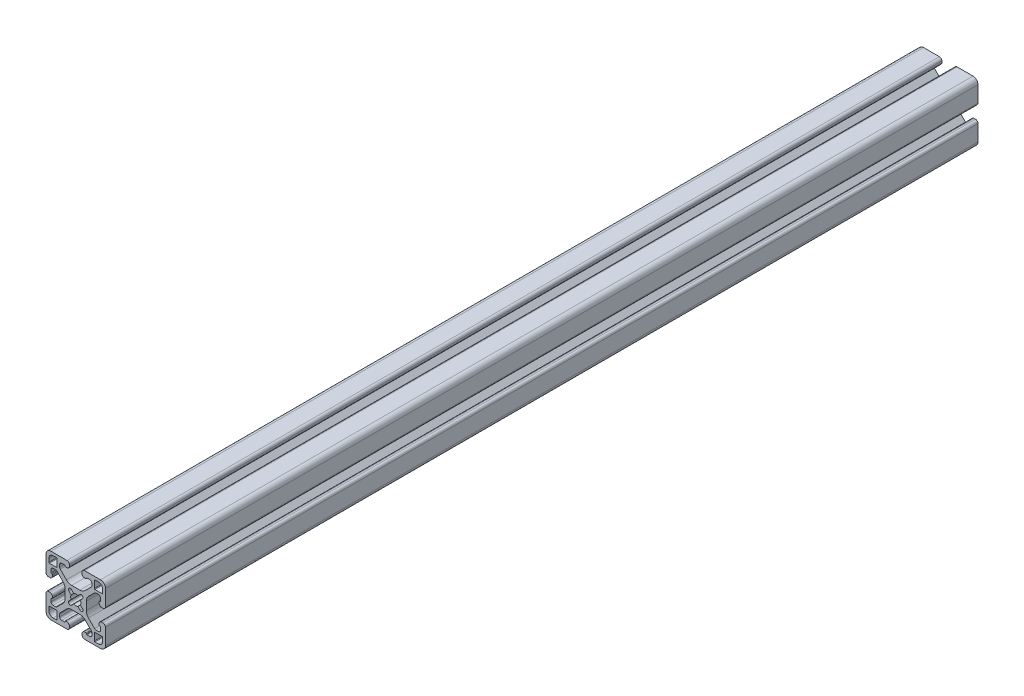
from build123d import *

# Parameters (mm, degrees)
EXTRUDE1_DEPTH = 558.8


with BuildPart() as part:
    # Sketch1 → Extrude1 (new body)
    with BuildSketch(Plane.XY):
        with BuildLine():
            Line((-46.536752228, -7.000622168), (-46.536752228, -8.774580164))
            ThreePointArc((-46.536752228, -8.774580164), (-46.907290083, -9.675221514), (-47.806745776, -10.048628264))
            Line((-47.806745776, -10.048628264), (-49.392633083, -10.048628264))
            ThreePointArc((-49.392633083, -10.048628264), (-49.878641042, -9.95195527), (-50.290658695, -9.676653876))
            Line((-50.290658695, -9.676653876), (-54.238761565, -5.728551005))
            ThreePointArc((-54.238761565, -5.728551005), (-55.26838878, -4.187604983), (-55.629945776, -2.369935216))
            Line((-55.629945776, -2.369935216), (-55.629945776, 2.846678689))
            ThreePointArc((-55.629945776, 2.846678689), (-55.26838878, 4.664348456), (-54.238761565, 6.205294478))
            Line((-54.238761565, 6.205294478), (-50.290658695, 10.153397348))
            ThreePointArc((-50.290658695, 10.153397348), (-49.878641042, 10.428698742), (-49.392633083, 10.525371736))
            Line((-49.392633083, 10.525371736), (-47.806745776, 10.525371736))
            ThreePointArc((-47.806745776, 10.525371736), (-46.907290079, 10.151964982), (-46.536752228, 9.251323623))
            Line((-46.536752228, 9.251323623), (-46.536752228, 7.47736564))
            ThreePointArc((-46.536752228, 7.47736564), (-46.648344767, 7.207957418), (-46.91775299, 7.096364878))
            Line((-46.91775299, 7.096364878), (-46.993953142, 7.096364878))
            ThreePointArc((-46.993953142, 7.096364878), (-47.263362671, 6.984771032), (-47.374953904, 6.715360422))
            Line((-47.374953904, 6.715360422), (-47.374945776, 5.877156465))
            ThreePointArc((-47.374945776, 5.877156465), (-46.913692136, 4.763614578), (-45.800145776, 4.302371736))
            Line((-45.800145776, 4.302371736), (-44.885745776, 4.302371736))
            ThreePointArc((-44.885745776, 4.302371736), (-43.772194017, 4.763619977), (-43.310945776, 5.877171736))
            Line((-43.310945776, 5.877171736), (-43.310945776, 16.113371736))
            ThreePointArc((-43.310945776, 16.113371736), (-44.240881746, 18.358435766), (-46.485945776, 19.288371736))
            Line((-46.485945776, 19.288371736), (-56.722145776, 19.288371736))
            ThreePointArc((-56.722145776, 19.288371736), (-57.835697535, 18.827123495), (-58.296945776, 17.713571736))
            Line((-58.296945776, 17.713571736), (-58.296945776, 16.799171736))
            ThreePointArc((-58.296945776, 16.799171736), (-57.835702934, 15.685625376), (-56.722161047, 15.224371736))
            Line((-56.722161047, 15.224371736), (-55.883957091, 15.224363608))
            ThreePointArc((-55.883957091, 15.224363608), (-55.61454648, 15.335954841), (-55.502952634, 15.60536437))
            Line((-55.502952634, 15.60536437), (-55.502952634, 15.681564523))
            ThreePointArc((-55.502952634, 15.681564523), (-55.391360095, 15.950972745), (-55.121951872, 16.062565285))
            Line((-55.121951872, 16.062565285), (-53.347993876, 16.062565285))
            ThreePointArc((-53.347993876, 16.062565285), (-52.447352526, 15.692027429), (-52.073945776, 14.792571736))
            Line((-52.073945776, 14.792571736), (-52.073945776, 13.206684429))
            ThreePointArc((-52.073945776, 13.206684429), (-52.17061877, 12.72067647), (-52.445920164, 12.308658817))
            Line((-52.445920164, 12.308658817), (-56.394023034, 8.360555947))
            ThreePointArc((-56.394023034, 8.360555947), (-57.934969057, 7.330928733), (-59.752638824, 6.969371736))
            Line((-59.752638824, 6.969371736), (-64.969252728, 6.969371736))
            ThreePointArc((-64.969252728, 6.969371736), (-66.786922496, 7.330928733), (-68.327868518, 8.360555947))
            Line((-68.327868518, 8.360555947), (-72.275971388, 12.308658817))
            ThreePointArc((-72.275971388, 12.308658817), (-72.551272782, 12.72067647), (-72.647945776, 13.206684429))
            Line((-72.647945776, 13.206684429), (-72.647945776, 14.792571736))
            ThreePointArc((-72.647945776, 14.792571736), (-72.274539022, 15.692027434), (-71.373897663, 16.062565285))
            Line((-71.373897663, 16.062565285), (-69.59993968, 16.062565285))
            ThreePointArc((-69.59993968, 16.062565285), (-69.330531458, 15.950972745), (-69.218938918, 15.681564523))
            Line((-69.218938918, 15.681564523), (-69.218938918, 15.60536437))
            ThreePointArc((-69.218938918, 15.60536437), (-69.107345072, 15.335954841), (-68.837934461, 15.224363608))
            Line((-68.837934461, 15.224363608), (-67.999730505, 15.224371736))
            ThreePointArc((-67.999730505, 15.224371736), (-66.886188618, 15.685625376), (-66.424945776, 16.799171736))
            Line((-66.424945776, 16.799171736), (-66.424945776, 17.713571736))
            ThreePointArc((-66.424945776, 17.713571736), (-66.886194017, 18.827123495), (-67.999745776, 19.288371736))
            Line((-67.999745776, 19.288371736), (-78.235945776, 19.288371736))
            ThreePointArc((-78.235945776, 19.288371736), (-80.481009806, 18.358435766), (-81.410945776, 16.113371736))
            Line((-81.410945776, 16.113371736), (-81.410945776, 5.877171736))
            ThreePointArc((-81.410945776, 5.877171736), (-80.949697535, 4.763619977), (-79.836145776, 4.302371736))
            Line((-79.836145776, 4.302371736), (-78.921745776, 4.302371736))
            ThreePointArc((-78.921745776, 4.302371736), (-77.808199416, 4.763614578), (-77.346945776, 5.877156465))
            Line((-77.346945776, 5.877156465), (-77.346937648, 6.715360422))
            ThreePointArc((-77.346937648, 6.715360422), (-77.458528881, 6.984771032), (-77.72793841, 7.096364878))
            Line((-77.72793841, 7.096364878), (-77.804138562, 7.096364878))
            ThreePointArc((-77.804138562, 7.096364878), (-78.073546785, 7.207957418), (-78.185139324, 7.47736564))
            Line((-78.185139324, 7.47736564), (-78.185139324, 9.251323637))
            ThreePointArc((-78.185139324, 9.251323637), (-77.814601469, 10.151964987), (-76.915145776, 10.525371736))
            Line((-76.915145776, 10.525371736), (-75.329258469, 10.525371736))
            ThreePointArc((-75.329258469, 10.525371736), (-74.84325051, 10.428698742), (-74.431232857, 10.153397348))
            Line((-74.431232857, 10.153397348), (-70.483129987, 6.205294478))
            ThreePointArc((-70.483129987, 6.205294478), (-69.453502773, 4.664348456), (-69.091945776, 2.846678689))
            Line((-69.091945776, 2.846678689), (-69.091945776, -2.369935216))
            ThreePointArc((-69.091945776, -2.369935216), (-69.453502773, -4.187604983), (-70.483129987, -5.728551005))
            Line((-70.483129987, -5.728551005), (-74.431232857, -9.676653876))
            ThreePointArc((-74.431232857, -9.676653876), (-74.84325051, -9.95195527), (-75.329258469, -10.048628264))
            Line((-75.329258469, -10.048628264), (-76.915145776, -10.048628264))
            ThreePointArc((-76.915145776, -10.048628264), (-77.814601474, -9.67522151), (-78.185139324, -8.774580151))
            Line((-78.185139324, -8.774580151), (-78.185139324, -7.000622168))
            ThreePointArc((-78.185139324, -7.000622168), (-78.073546785, -6.731213945), (-77.804138562, -6.619621406))
            Line((-77.804138562, -6.619621406), (-77.72793841, -6.619621406))
            ThreePointArc((-77.72793841, -6.619621406), (-77.458528881, -6.50802756), (-77.346937648, -6.238616949))
            Line((-77.346937648, -6.238616949), (-77.346945776, -5.400412993))
            ThreePointArc((-77.346945776, -5.400412993), (-77.808199416, -4.286871106), (-78.921745776, -3.825628264))
            Line((-78.921745776, -3.825628264), (-79.836145776, -3.825628264))
            ThreePointArc((-79.836145776, -3.825628264), (-80.949697535, -4.286876505), (-81.410945776, -5.400428264))
            Line((-81.410945776, -5.400428264), (-81.410945776, -15.636628264))
            ThreePointArc((-81.410945776, -15.636628264), (-80.481009806, -17.881692294), (-78.235945776, -18.811628264))
            Line((-78.235945776, -18.811628264), (-67.999745776, -18.811628264))
            ThreePointArc((-67.999745776, -18.811628264), (-66.886194017, -18.350380023), (-66.424945776, -17.236828264))
            Line((-66.424945776, -17.236828264), (-66.424945776, -16.322428264))
            ThreePointArc((-66.424945776, -16.322428264), (-66.886188618, -15.208881904), (-67.999730505, -14.747628264))
            Line((-67.999730505, -14.747628264), (-68.837934461, -14.747620136))
            ThreePointArc((-68.837934461, -14.747620136), (-69.107345072, -14.859211369), (-69.218938918, -15.128620898))
            Line((-69.218938918, -15.128620898), (-69.218938918, -15.20482105))
            ThreePointArc((-69.218938918, -15.20482105), (-69.330531458, -15.474229273), (-69.59993968, -15.585821812))
            Line((-69.59993968, -15.585821812), (-71.373897676, -15.585821812))
            ThreePointArc((-71.373897676, -15.585821812), (-72.274539027, -15.215283957), (-72.647945776, -14.315828264))
            Line((-72.647945776, -14.315828264), (-72.647945776, -12.729940957))
            ThreePointArc((-72.647945776, -12.729940957), (-72.551272782, -12.243932998), (-72.275971388, -11.831915345))
            Line((-72.275971388, -11.831915345), (-68.327868518, -7.883812475))
            ThreePointArc((-68.327868518, -7.883812475), (-66.786922496, -6.85418526), (-64.969252728, -6.492628264))
            Line((-64.969252728, -6.492628264), (-59.752638824, -6.492628264))
            ThreePointArc((-59.752638824, -6.492628264), (-57.934969057, -6.85418526), (-56.394023034, -7.883812475))
            Line((-56.394023034, -7.883812475), (-52.445920164, -11.831915345))
            ThreePointArc((-52.445920164, -11.831915345), (-52.17061877, -12.243932998), (-52.073945776, -12.729940957))
            Line((-52.073945776, -12.729940957), (-52.073945776, -14.315828264))
            ThreePointArc((-52.073945776, -14.315828264), (-52.44735253, -15.215283961), (-53.347993889, -15.585821812))
            Line((-53.347993889, -15.585821812), (-55.121951872, -15.585821812))
            ThreePointArc((-55.121951872, -15.585821812), (-55.391360095, -15.474229273), (-55.502952634, -15.20482105))
            Line((-55.502952634, -15.20482105), (-55.502952634, -15.128620898))
            ThreePointArc((-55.502952634, -15.128620898), (-55.61454648, -14.859211369), (-55.883957091, -14.747620136))
            Line((-55.883957091, -14.747620136), (-56.722161047, -14.747628264))
            ThreePointArc((-56.722161047, -14.747628264), (-57.835702934, -15.208881904), (-58.296945776, -16.322428264))
            Line((-58.296945776, -16.322428264), (-58.296945776, -17.236828264))
            ThreePointArc((-58.296945776, -17.236828264), (-57.835697535, -18.350380023), (-56.722145776, -18.811628264))
            Line((-56.722145776, -18.811628264), (-46.485945776, -18.811628264))
            ThreePointArc((-46.485945776, -18.811628264), (-44.240881746, -17.881692294), (-43.310945776, -15.636628264))
            Line((-43.310945776, -15.636628264), (-43.310945776, -5.400428264))
            ThreePointArc((-43.310945776, -5.400428264), (-43.772194017, -4.286876505), (-44.885745776, -3.825628264))
            Line((-44.885745776, -3.825628264), (-45.800145776, -3.825628264))
            ThreePointArc((-45.800145776, -3.825628264), (-46.913692136, -4.286871106), (-47.374945776, -5.400412993))
            Line((-47.374945776, -5.400412993), (-47.374953904, -6.238616949))
            ThreePointArc((-47.374953904, -6.238616949), (-47.263362671, -6.50802756), (-46.993953142, -6.619621406))
            Line((-46.993953142, -6.619621406), (-46.91775299, -6.619621406))
            ThreePointArc((-46.91775299, -6.619621406), (-46.648344767, -6.731213945), (-46.536752228, -7.000622168))
        make_face()
        with BuildLine():
            Line((-66.704246649, -2.488483035), (-65.333825803, -1.118062189))
            ThreePointArc((-65.333825803, -1.118062189), (-65.628655776, 0.238371736), (-65.333825803, 1.594805661))
            Line((-65.333825803, 1.594805661), (-66.704246649, 2.965226507))
            ThreePointArc((-66.704246649, 2.965226507), (-66.704246649, 4.581672609), (-65.087800547, 4.581672609))
            Line((-65.087800547, 4.581672609), (-63.717379701, 3.211251763))
            ThreePointArc((-63.717379701, 3.211251763), (-62.360945776, 3.506081736), (-61.004511851, 3.211251763))
            Line((-61.004511851, 3.211251763), (-59.721184579, 4.483982556))
            ThreePointArc((-59.721184579, 4.483982556), (-58.017644903, 4.581672609), (-58.115334956, 2.878132934))
            Line((-58.115334956, 2.878132934), (-59.38806575, 1.594805661))
            ThreePointArc((-59.38806575, 1.594805661), (-59.093235776, 0.238371736), (-59.38806575, -1.118062189))
            Line((-59.38806575, -1.118062189), (-58.017644903, -2.488483035))
            ThreePointArc((-58.017644903, -2.488483035), (-58.017644903, -4.104929137), (-59.634091005, -4.104929137))
            Line((-59.634091005, -4.104929137), (-61.004511851, -2.73450829))
            ThreePointArc((-61.004511851, -2.73450829), (-62.360945776, -3.029338264), (-63.717379701, -2.73450829))
            Line((-63.717379701, -2.73450829), (-65.087800547, -4.104929137))
            ThreePointArc((-65.087800547, -4.104929137), (-66.704246649, -4.104929137), (-66.704246649, -2.488483035))
        make_face(mode=Mode.SUBTRACT)
        with BuildLine():
            Line((-79.607545776, 12.481171736), (-79.607545776, 14.690971736))
            ThreePointArc((-79.607545776, 14.690971736), (-78.789202123, 16.666628083), (-76.813545776, 17.484971736))
            Line((-76.813545776, 17.484971736), (-74.603745776, 17.484971736))
            ThreePointArc((-74.603745776, 17.484971736), (-74.334338092, 17.37337942), (-74.222745776, 17.103971736))
            Line((-74.222745776, 17.103971736), (-74.222745776, 12.481171736))
            ThreePointArc((-74.222745776, 12.481171736), (-74.334338092, 12.211764053), (-74.603745776, 12.100171736))
            Line((-74.603745776, 12.100171736), (-79.226545776, 12.100171736))
            ThreePointArc((-79.226545776, 12.100171736), (-79.49595346, 12.211764053), (-79.607545776, 12.481171736))
        make_face(mode=Mode.SUBTRACT)
        with BuildLine():
            Line((-74.603745776, -17.008228264), (-76.813545776, -17.008228264))
            ThreePointArc((-76.813545776, -17.008228264), (-78.789202123, -16.18988461), (-79.607545776, -14.214228264))
            Line((-79.607545776, -14.214228264), (-79.607545776, -12.004428264))
            ThreePointArc((-79.607545776, -12.004428264), (-79.49595346, -11.73502058), (-79.226545776, -11.623428264))
            Line((-79.226545776, -11.623428264), (-74.603745776, -11.623428264))
            ThreePointArc((-74.603745776, -11.623428264), (-74.334338092, -11.73502058), (-74.222745776, -12.004428264))
            Line((-74.222745776, -12.004428264), (-74.222745776, -16.627228264))
            ThreePointArc((-74.222745776, -16.627228264), (-74.334338092, -16.896635947), (-74.603745776, -17.008228264))
        make_face(mode=Mode.SUBTRACT)
        with BuildLine():
            Line((-45.114345776, -12.004428264), (-45.114345776, -14.214228264))
            ThreePointArc((-45.114345776, -14.214228264), (-45.932689429, -16.18988461), (-47.908345776, -17.008228264))
            Line((-47.908345776, -17.008228264), (-50.118145776, -17.008228264))
            ThreePointArc((-50.118145776, -17.008228264), (-50.38755346, -16.896635947), (-50.499145776, -16.627228264))
            Line((-50.499145776, -16.627228264), (-50.499145776, -12.004428264))
            ThreePointArc((-50.499145776, -12.004428264), (-50.38755346, -11.73502058), (-50.118145776, -11.623428264))
            Line((-50.118145776, -11.623428264), (-45.495345776, -11.623428264))
            ThreePointArc((-45.495345776, -11.623428264), (-45.225938092, -11.73502058), (-45.114345776, -12.004428264))
        make_face(mode=Mode.SUBTRACT)
        with BuildLine():
            Line((-50.118145776, 17.484971736), (-47.908345776, 17.484971736))
            ThreePointArc((-47.908345776, 17.484971736), (-45.932689429, 16.666628083), (-45.114345776, 14.690971736))
            Line((-45.114345776, 14.690971736), (-45.114345776, 12.481171736))
            ThreePointArc((-45.114345776, 12.481171736), (-45.225938092, 12.211764053), (-45.495345776, 12.100171736))
            Line((-45.495345776, 12.100171736), (-50.118145776, 12.100171736))
            ThreePointArc((-50.118145776, 12.100171736), (-50.38755346, 12.211764053), (-50.499145776, 12.481171736))
            Line((-50.499145776, 12.481171736), (-50.499145776, 17.103971736))
            ThreePointArc((-50.499145776, 17.103971736), (-50.38755346, 17.37337942), (-50.118145776, 17.484971736))
        make_face(mode=Mode.SUBTRACT)
    extrude(amount=-EXTRUDE1_DEPTH)


solid = part.part
